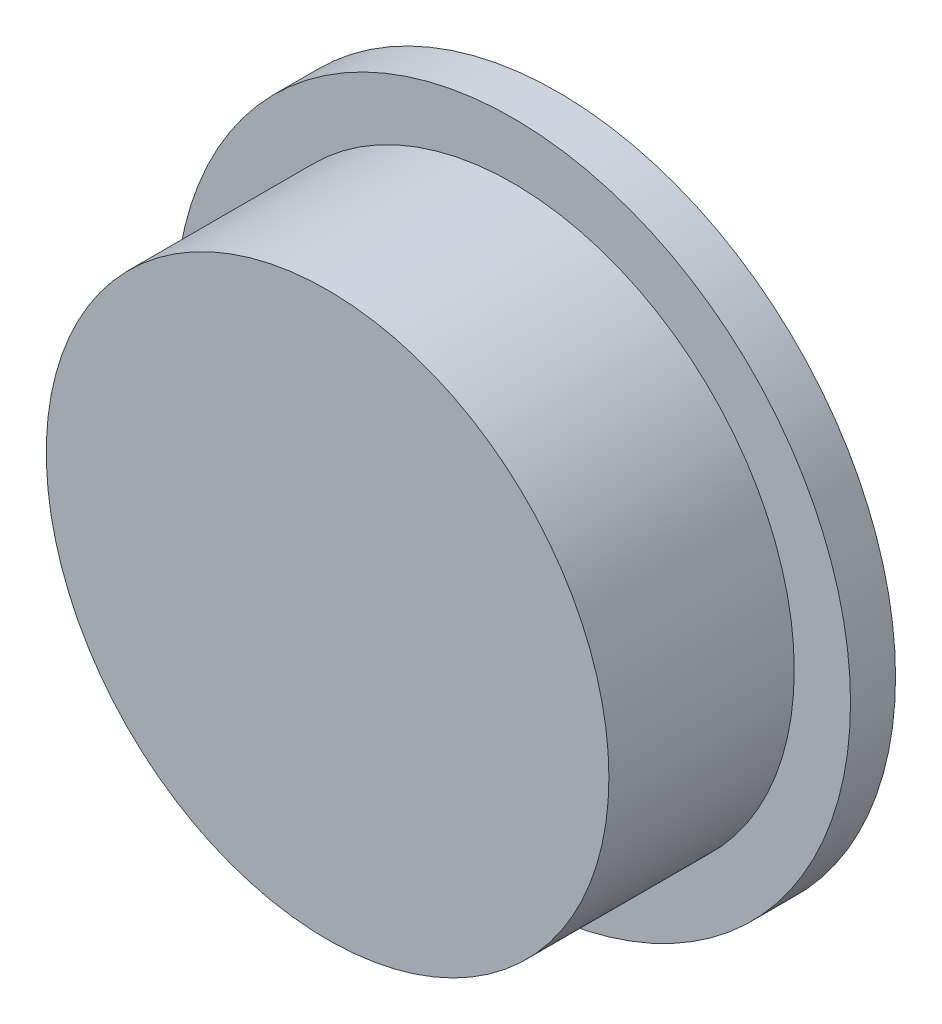
from build123d import *

# Parameters (mm, degrees)
SKETCH1_R           = 7.62
BOSS_EXTRUDE1_DEPTH = 1.016
SKETCH2_R           = 6.35
BOSS_EXTRUDE2_DEPTH = 4.18338


with BuildPart() as part:
    # Sketch1 → Boss-Extrude1 (new body)
    with BuildSketch(Plane.XY):
        Circle(SKETCH1_R)
    extrude(amount=BOSS_EXTRUDE1_DEPTH)

    # Sketch2 → Boss-Extrude2 (add)
    with BuildSketch(Plane.XY.offset(1.016)):
        Circle(SKETCH2_R)
    extrude(amount=BOSS_EXTRUDE2_DEPTH)


solid = part.part
